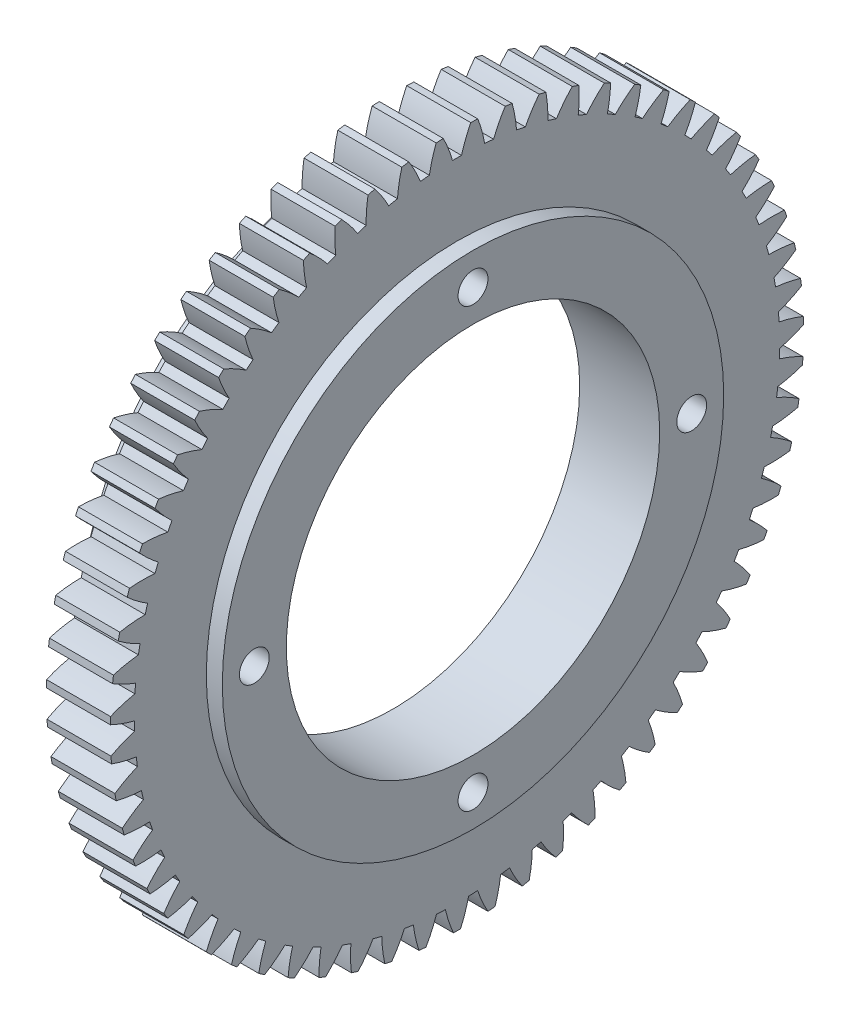
from build123d import *

# Parameters (mm, degrees)
BASPROSKE_W                  = 12
BASPROSKE_H                  = 65
TOOTHCUT_DEPTH               = 93.703829479
TEETHCUTS_COUNT              = 63
TEETHCUTS_ANGLE              = 354.285714286
BORSKE_R                     = 35
BORE_DEPTH                   = 50.0000508
ESTRUSIONE_ESTRUSIONE1_START = 3
SCHIZZO1_R                   = 47
SCHIZZO1_R_2                 = 35
ESTRUSIONE_ESTRUSIONE1_DEPTH = 3
SCHIZZO2_R                   = 53
SCHIZZO2_R_2                 = 50
ESTRUSIONE_ESTRUSIONE2_DEPTH = 6
FORO_PER_VITE_M3_1_D         = 5.6
FORO_PER_VITE_M3_1_DEPTH     = 8.1
FORO_PER_VITE_M3_1_TIP       = 1.682409733


with BuildPart() as part:
    # BasProSke → Base-Revolve (revolve)
    with BuildSketch(Plane(origin=(0, 0, 0), x_dir=(1, 0, 0), z_dir=(0, 1, 0)), mode=Mode.PRIVATE) as base_revolve_sk:
        with Locations((6, 32.5)):
            Rectangle(BASPROSKE_W, BASPROSKE_H)
    revolve(base_revolve_sk.sketch.rotate(Axis((-10, 0, 0), (1, 0, 0)), 180), axis=Axis((-10, 0, 0), (1, 0, 0)))

    # TooCutSke → ToothCut (cut, through all)
    with BuildSketch(Plane(origin=(0, 0, 0), x_dir=(0, 0, -1), z_dir=(1, 0, 0))):
        with BuildLine():
            ThreePointArc((0.841839749, 60.493142643), (0, 60.499), (-0.841839749, 60.493142643))
            ThreePointArc((-0.841839749, 60.493142643), (-1.608077994, 62.775262647), (-2.588578901, 64.973855545))
            ThreePointArc((-2.588578901, 64.973855545), (0, 65.0254), (2.588578901, 64.973855545))
            ThreePointArc((2.588578901, 64.973855545), (1.608077994, 62.775262647), (0.841839749, 60.493142643))
        make_face()
    toothcut = extrude(amount=TOOTHCUT_DEPTH, mode=Mode.SUBTRACT)

    # TeethCuts: ToothCut ×63 about axis
    teethcuts_axis = Axis((-10, 0, 0), (1, 0, 0))
    for i in range(1, TEETHCUTS_COUNT):
        add(toothcut.rotate(teethcuts_axis, i * TEETHCUTS_ANGLE / (TEETHCUTS_COUNT - 1)), mode=Mode.SUBTRACT)

    # BorSke → Bore (cut, symmetric)
    with BuildSketch(Plane(origin=(0, 0, 0), x_dir=(0, 0, -1), z_dir=(1, 0, 0))):
        with Locations(Location((0, 0, 0), (0, 0, 180))):
            Circle(BORSKE_R)
    extrude(amount=BORE_DEPTH, both=True, mode=Mode.SUBTRACT)

    # Schizzo1 → Estrusione-Estrusione1 (add)
    with BuildSketch(Plane(origin=(12, 0, 0), x_dir=(0, 0, -1), z_dir=(1, 0, 0)).offset(ESTRUSIONE_ESTRUSIONE1_START)):
        with Locations(Location((0, 0, 0), (0, 0, 180))):
            Circle(SCHIZZO1_R)
        Circle(SCHIZZO1_R_2, mode=Mode.SUBTRACT)
    extrude(amount=-ESTRUSIONE_ESTRUSIONE1_DEPTH)

    # Schizzo2 → Estrusione-Estrusione2 (add)
    with BuildSketch(Plane.ZY):
        with Locations(Location((0, 0, 0), (0, 0, 180))):
            Circle(SCHIZZO2_R)
        Circle(SCHIZZO2_R_2, mode=Mode.SUBTRACT)
    extrude(amount=ESTRUSIONE_ESTRUSIONE2_DEPTH)

    # Foro per Vite M3-1
    with Locations(Plane(origin=(15, 0, 0), x_dir=(0, 0, -1), z_dir=(1, 0, 0))):
        with Locations((0, 41), (-41, 0), (41, 0), (0, -41)):
            Hole(FORO_PER_VITE_M3_1_D / 2, depth=FORO_PER_VITE_M3_1_DEPTH)
            with Locations((0, 0, -(FORO_PER_VITE_M3_1_DEPTH + FORO_PER_VITE_M3_1_TIP / 2))):  # 118° drill point
                Cone(0, FORO_PER_VITE_M3_1_D / 2, FORO_PER_VITE_M3_1_TIP, mode=Mode.SUBTRACT)


solid = part.part
